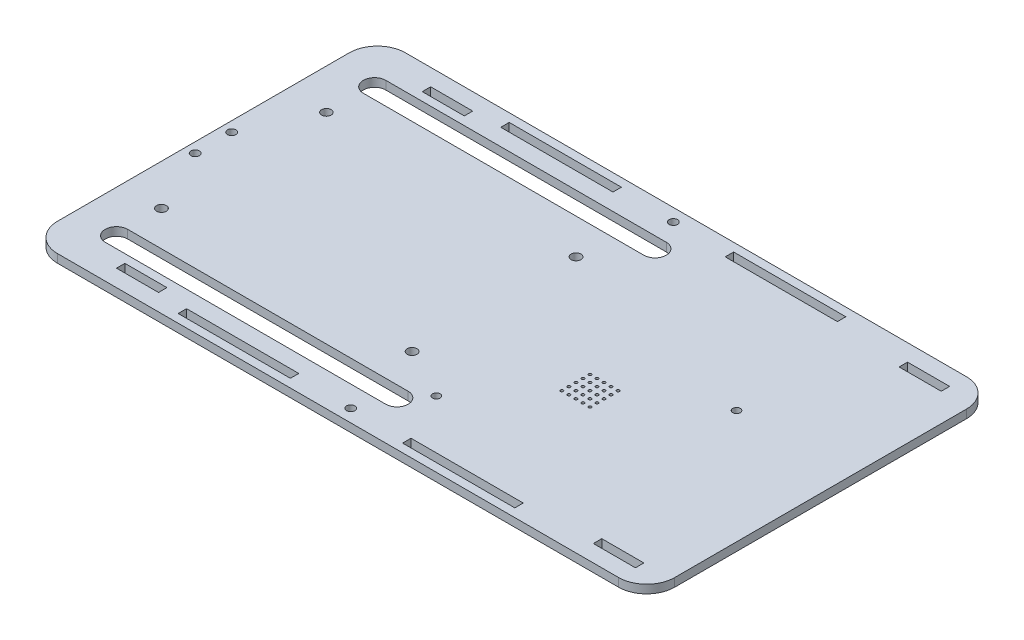
from build123d import *

# Parameters (mm, degrees)
SKETCH1_R           = 1.35
BOSS_EXTRUDE1_DEPTH = 3
SKETCH4_R           = 1.5
SKETCH4_W           = 40
SKETCH4_H           = 3
CUT_EXTRUDE1_DEPTH  = 3
SKETCH5_R           = 1.7
SKETCH5_R_2         = 1.75
CUT_EXTRUDE2_DEPTH  = 3
SKETCH6_R           = 0.5
CUT_EXTRUDE3_DEPTH  = 3
SKETCH7_R           = 1.5
CUT_EXTRUDE4_DEPTH  = 3
CUT_EXTRUDE5_DEPTH  = 3
SKETCH9_W           = 15
SKETCH9_H           = 3
CUT_EXTRUDE6_DEPTH  = 3


with BuildPart() as part:
    # Sketch1 → Boss-Extrude1 (new body)
    with BuildSketch(Plane(origin=(0, 0, 0), x_dir=(1, 0, 0), z_dir=(0, 1, 0))):
        with BuildLine():
            Line((-100, -62), (100, -62))
            ThreePointArc((100, -62), (107.071067812, -59.071067812), (110, -52))
            Line((110, -52), (110, 52))
            ThreePointArc((110, 52), (107.071067812, 59.071067812), (100, 62))
            Line((100, 62), (-100, 62))
            ThreePointArc((-100, 62), (-107.071067812, 59.071067812), (-110, 52))
            Line((-110, 52), (-110, -52))
            ThreePointArc((-110, -52), (-107.071067812, -59.071067812), (-100, -62))
        make_face()
        with Locations(Location((69.472640088, 10.571681526, 0), (0, 0, 270))):
            Circle(SKETCH1_R, mode=Mode.SUBTRACT)
        with Locations(Location((11.472640088, -38.428318474, 0), (0, 0, 270))):
            Circle(SKETCH1_R, mode=Mode.SUBTRACT)
    extrude(amount=BOSS_EXTRUDE1_DEPTH)

    # Sketch4 → Cut-Extrude1 (cut)
    with BuildSketch(Plane(origin=(0, 3, 0), x_dir=(1, 0, 0), z_dir=(0, 1, 0))):
        with Locations(Location((0, -57.5, 0), (0, 0, 270))):
            Circle(SKETCH4_R)
        with Locations(Location((0, 57.5, 0), (0, 0, 90))):
            Circle(SKETCH4_R)
        with Locations((-40, -57.5)):
            Rectangle(SKETCH4_W, SKETCH4_H)
        with Locations((40, -57.5)):
            Rectangle(SKETCH4_W, SKETCH4_H)
        with Locations((-40, 57.5)):
            Rectangle(SKETCH4_W, SKETCH4_H)
        with Locations((40, 57.5)):
            Rectangle(SKETCH4_W, SKETCH4_H)
    extrude(amount=-CUT_EXTRUDE1_DEPTH, mode=Mode.SUBTRACT)

    # Sketch5 → Cut-Extrude2 (cut)
    with BuildSketch(Plane(origin=(0, 3, 0), x_dir=(1, 0, 0), z_dir=(0, 1, 0))):
        with Locations(Location((-95.681755145, 29.511348179, 0), (0, 0, 270))):
            Circle(SKETCH5_R)
        with Locations(Location((-95.425501916, -29.52854371, 0), (0, 0, 270))):
            Circle(SKETCH5_R_2)
        with Locations(Location((-6.575715248, -29.029034924, 0), (0, 0, 270))):
            Circle(SKETCH5_R_2)
        with Locations(Location((-6.581697253, 29.400968192, 0), (0, 0, 270))):
            Circle(SKETCH5_R_2)
    extrude(amount=-CUT_EXTRUDE2_DEPTH, mode=Mode.SUBTRACT)

    # Sketch6 → Cut-Extrude3 (cut)
    with BuildSketch(Plane(origin=(0, 3, 0), x_dir=(1, 0, 0), z_dir=(0, 1, 0))):
        with Locations(Location((32.222640088, -4.428318474, 0), (0, 0, 270))):
            Circle(SKETCH6_R)
        with Locations(Location((34.722640088, -4.428318474, 0), (0, 0, 270))):
            Circle(SKETCH6_R)
        with Locations(Location((37.222640088, -4.428318474, 0), (0, 0, 270))):
            Circle(SKETCH6_R)
        with Locations(Location((39.722640088, -4.428318474, 0), (0, 0, 270))):
            Circle(SKETCH6_R)
        with Locations((-29.984615318, 187.322240446)):
            Circle(SKETCH6_R)
        with Locations(Location((42.222640088, -4.428318474, 0), (0, 0, 270))):
            Circle(SKETCH6_R)
        with Locations(Location((32.222640088, -6.928318474, 0), (0, 0, 270))):
            Circle(SKETCH6_R)
        with Locations(Location((34.722640088, -6.928318474, 0), (0, 0, 270))):
            Circle(SKETCH6_R)
        with Locations(Location((37.222640088, -6.928318474, 0), (0, 0, 270))):
            Circle(SKETCH6_R)
        with Locations(Location((39.722640088, -6.928318474, 0), (0, 0, 270))):
            Circle(SKETCH6_R)
        with Locations(Location((42.222640088, -6.928318474, 0), (0, 0, 270))):
            Circle(SKETCH6_R)
        with Locations(Location((32.222640088, -9.428318474, 0), (0, 0, 270))):
            Circle(SKETCH6_R)
        with Locations(Location((34.722640088, -9.428318474, 0), (0, 0, 270))):
            Circle(SKETCH6_R)
        with Locations(Location((37.222640088, -9.428318474, 0), (0, 0, 270))):
            Circle(SKETCH6_R)
        with Locations(Location((39.722640088, -9.428318474, 0), (0, 0, 270))):
            Circle(SKETCH6_R)
        with Locations(Location((42.222640088, -9.428318474, 0), (0, 0, 270))):
            Circle(SKETCH6_R)
        with Locations(Location((32.222640088, -11.928318474, 0), (0, 0, 270))):
            Circle(SKETCH6_R)
        with Locations(Location((34.722640088, -11.928318474, 0), (0, 0, 270))):
            Circle(SKETCH6_R)
        with Locations(Location((37.222640088, -11.928318474, 0), (0, 0, 270))):
            Circle(SKETCH6_R)
        with Locations(Location((39.722640088, -11.928318474, 0), (0, 0, 270))):
            Circle(SKETCH6_R)
        with Locations(Location((42.222640088, -11.928318474, 0), (0, 0, 270))):
            Circle(SKETCH6_R)
        with Locations(Location((32.222640088, -14.428318474, 0), (0, 0, 270))):
            Circle(SKETCH6_R)
        with Locations(Location((34.722640088, -14.428318474, 0), (0, 0, 270))):
            Circle(SKETCH6_R)
        with Locations(Location((37.222640088, -14.428318474, 0), (0, 0, 270))):
            Circle(SKETCH6_R)
        with Locations(Location((39.722640088, -14.428318474, 0), (0, 0, 270))):
            Circle(SKETCH6_R)
        with Locations(Location((42.222640088, -14.428318474, 0), (0, 0, 270))):
            Circle(SKETCH6_R)
    extrude(amount=-CUT_EXTRUDE3_DEPTH, mode=Mode.SUBTRACT)

    # Sketch7 → Cut-Extrude4 (cut)
    with BuildSketch(Plane(origin=(0, 3, 0), x_dir=(1, 0, 0), z_dir=(0, 1, 0))):
        with Locations(Location((-106.437330196, 6.5, 0), (0, 0, 270))):
            Circle(SKETCH7_R)
        with Locations(Location((-106.437330196, -6.5, 0), (0, 0, 270))):
            Circle(SKETCH7_R)
    extrude(amount=-CUT_EXTRUDE4_DEPTH, mode=Mode.SUBTRACT)

    # Sketch8 → Cut-Extrude5 (cut)
    with BuildSketch(Plane(origin=(0, 3, 0), x_dir=(1, 0, 0), z_dir=(0, 1, 0))):
        with BuildLine():
            Line((-95, 50), (5, 50))
            ThreePointArc((5, 50), (9, 46), (5, 42))
            Line((5, 42), (-95, 42))
            ThreePointArc((-95, 42), (-99, 46), (-95, 50))
        make_face()
        with BuildLine():
            Line((-95, -42), (5, -42))
            ThreePointArc((5, -42), (9, -46), (5, -50))
            Line((5, -50), (-95, -50))
            ThreePointArc((-95, -50), (-99, -46), (-95, -42))
        make_face()
    extrude(amount=-CUT_EXTRUDE5_DEPTH, mode=Mode.SUBTRACT)

    # Sketch9 → Cut-Extrude6 (cut)
    with BuildSketch(Plane(origin=(0, 3, 0), x_dir=(1, 0, 0), z_dir=(0, 1, 0))):
        with Locations((-77.5, -54.5)):
            Rectangle(SKETCH9_W, SKETCH9_H)
        with Locations((-77.5, 54.5)):
            Rectangle(SKETCH9_W, SKETCH9_H)
        with Locations((92.5, 54.5)):
            Rectangle(SKETCH9_W, SKETCH9_H)
        with Locations((92.5, -54.5)):
            Rectangle(SKETCH9_W, SKETCH9_H)
    extrude(amount=-CUT_EXTRUDE6_DEPTH, mode=Mode.SUBTRACT)


solid = part.part
